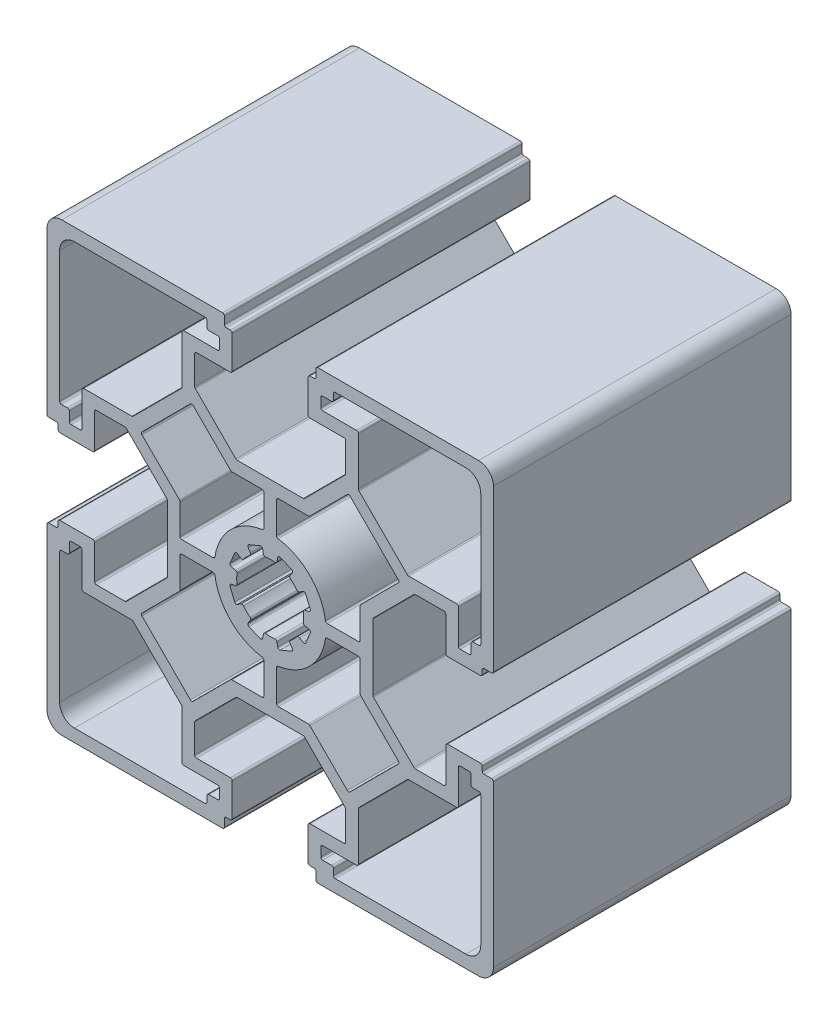
from build123d import *

# Parameters (mm, degrees)
Y_KSEKLIK_EKSTR_ZYON2_DEPTH = 40


with BuildPart() as part:
    # Çizim3 → Yükseklik-Ekstrüzyon2 (new body)
    with BuildSketch(Plane.XY):
        with BuildLine():
            Line((-4.433347776, -13.8), (4.433347776, -13.8))
            ThreePointArc((4.433347776, -13.8), (4.529018634, -13.819030117), (4.610124471, -13.873223305))
            Line((4.610124471, -13.873223305), (10.076776695, -19.339875529))
            ThreePointArc((10.076776695, -19.339875529), (10.130969883, -19.420981366), (10.15, -19.516652224))
            Line((10.15, -19.516652224), (10.15, -23.35))
            ThreePointArc((10.15, -23.35), (10.076776695, -23.526776695), (9.9, -23.6))
            Line((9.9, -23.6), (5.35, -23.6))
            ThreePointArc((5.35, -23.6), (5.173223305, -23.673223305), (5.1, -23.85))
            Line((5.1, -23.85), (5.1, -28.25))
            ThreePointArc((5.1, -28.25), (5.173223305, -28.426776695), (5.35, -28.5))
            Line((5.35, -28.5), (5.9, -28.5))
            ThreePointArc((5.9, -28.5), (6.076776695, -28.573223305), (6.15, -28.75))
            Line((6.15, -28.75), (6.15, -29.75))
            ThreePointArc((6.15, -29.75), (6.223223305, -29.926776695), (6.4, -30))
            Line((6.4, -30), (28, -30))
            ThreePointArc((28, -30), (29.414213562, -29.414213562), (30, -28))
            Line((30, -28), (30, -6.4))
            ThreePointArc((30, -6.4), (29.926776695, -6.223223305), (29.75, -6.15))
            Line((29.75, -6.15), (28.75, -6.15))
            ThreePointArc((28.75, -6.15), (28.573223305, -6.076776695), (28.5, -5.9))
            Line((28.5, -5.9), (28.5, -5.35))
            ThreePointArc((28.5, -5.35), (28.426776695, -5.173223305), (28.25, -5.1))
            Line((28.25, -5.1), (23.85, -5.1))
            ThreePointArc((23.85, -5.1), (23.673223305, -5.173223305), (23.6, -5.35))
            Line((23.6, -5.35), (23.6, -9.9))
            ThreePointArc((23.6, -9.9), (23.526776695, -10.076776695), (23.35, -10.15))
            Line((23.35, -10.15), (19.516652224, -10.15))
            ThreePointArc((19.516652224, -10.15), (19.420981366, -10.130969883), (19.339875529, -10.076776695))
            Line((19.339875529, -10.076776695), (13.873223305, -4.610124471))
            ThreePointArc((13.873223305, -4.610124471), (13.819030117, -4.529018634), (13.8, -4.433347776))
            Line((13.8, -4.433347776), (13.8, 4.433347776))
            ThreePointArc((13.8, 4.433347776), (13.819030117, 4.529018634), (13.873223305, 4.610124471))
            Line((13.873223305, 4.610124471), (19.339875529, 10.076776695))
            ThreePointArc((19.339875529, 10.076776695), (19.420981366, 10.130969883), (19.516652224, 10.15))
            Line((19.516652224, 10.15), (23.35, 10.15))
            ThreePointArc((23.35, 10.15), (23.526776695, 10.076776695), (23.6, 9.9))
            Line((23.6, 9.9), (23.6, 5.35))
            ThreePointArc((23.6, 5.35), (23.673223305, 5.173223305), (23.85, 5.1))
            Line((23.85, 5.1), (28.25, 5.1))
            ThreePointArc((28.25, 5.1), (28.426776695, 5.173223305), (28.5, 5.35))
            Line((28.5, 5.35), (28.5, 5.9))
            ThreePointArc((28.5, 5.9), (28.573223305, 6.076776695), (28.75, 6.15))
            Line((28.75, 6.15), (29.75, 6.15))
            ThreePointArc((29.75, 6.15), (29.926776695, 6.223223305), (30, 6.4))
            Line((30, 6.4), (30, 28))
            ThreePointArc((30, 28), (29.414213562, 29.414213562), (28, 30))
            Line((28, 30), (6.4, 30))
            ThreePointArc((6.4, 30), (6.223223305, 29.926776695), (6.15, 29.75))
            Line((6.15, 29.75), (6.15, 28.75))
            ThreePointArc((6.15, 28.75), (6.076776695, 28.573223305), (5.9, 28.5))
            Line((5.9, 28.5), (5.35, 28.5))
            ThreePointArc((5.35, 28.5), (5.173223305, 28.426776695), (5.1, 28.25))
            Line((5.1, 28.25), (5.1, 23.85))
            ThreePointArc((5.1, 23.85), (5.173223305, 23.673223305), (5.35, 23.6))
            Line((5.35, 23.6), (9.9, 23.6))
            ThreePointArc((9.9, 23.6), (10.076776695, 23.526776695), (10.15, 23.35))
            Line((10.15, 23.35), (10.15, 19.516652224))
            ThreePointArc((10.15, 19.516652224), (10.130969883, 19.420981366), (10.076776695, 19.339875529))
            Line((10.076776695, 19.339875529), (4.610124471, 13.873223305))
            ThreePointArc((4.610124471, 13.873223305), (4.529018634, 13.819030117), (4.433347776, 13.8))
            Line((4.433347776, 13.8), (-4.433347776, 13.8))
            ThreePointArc((-4.433347776, 13.8), (-4.529018634, 13.819030117), (-4.610124471, 13.873223305))
            Line((-4.610124471, 13.873223305), (-10.076776695, 19.339875529))
            ThreePointArc((-10.076776695, 19.339875529), (-10.130969883, 19.420981366), (-10.15, 19.516652224))
            Line((-10.15, 19.516652224), (-10.15, 23.35))
            ThreePointArc((-10.15, 23.35), (-10.076776695, 23.526776695), (-9.9, 23.6))
            Line((-9.9, 23.6), (-5.35, 23.6))
            ThreePointArc((-5.35, 23.6), (-5.173223305, 23.673223305), (-5.1, 23.85))
            Line((-5.1, 23.85), (-5.1, 28.25))
            ThreePointArc((-5.1, 28.25), (-5.173223305, 28.426776695), (-5.35, 28.5))
            Line((-5.35, 28.5), (-5.9, 28.5))
            ThreePointArc((-5.9, 28.5), (-6.076776695, 28.573223305), (-6.15, 28.75))
            Line((-6.15, 28.75), (-6.15, 29.75))
            ThreePointArc((-6.15, 29.75), (-6.223223305, 29.926776695), (-6.4, 30))
            Line((-6.4, 30), (-28, 30))
            ThreePointArc((-28, 30), (-29.414213562, 29.414213562), (-30, 28))
            Line((-30, 28), (-30, 6.4))
            ThreePointArc((-30, 6.4), (-29.926776695, 6.223223305), (-29.75, 6.15))
            Line((-29.75, 6.15), (-28.75, 6.15))
            ThreePointArc((-28.75, 6.15), (-28.573223305, 6.076776695), (-28.5, 5.9))
            Line((-28.5, 5.9), (-28.5, 5.35))
            ThreePointArc((-28.5, 5.35), (-28.426776695, 5.173223305), (-28.25, 5.1))
            Line((-28.25, 5.1), (-23.85, 5.1))
            ThreePointArc((-23.85, 5.1), (-23.673223305, 5.173223305), (-23.6, 5.35))
            Line((-23.6, 5.35), (-23.6, 9.9))
            ThreePointArc((-23.6, 9.9), (-23.526776695, 10.076776695), (-23.35, 10.15))
            Line((-23.35, 10.15), (-19.516652224, 10.15))
            ThreePointArc((-19.516652224, 10.15), (-19.420981366, 10.130969883), (-19.339875529, 10.076776695))
            Line((-19.339875529, 10.076776695), (-13.873223305, 4.610124471))
            ThreePointArc((-13.873223305, 4.610124471), (-13.819030117, 4.529018634), (-13.8, 4.433347776))
            Line((-13.8, 4.433347776), (-13.8, -4.433347776))
            ThreePointArc((-13.8, -4.433347776), (-13.819030117, -4.529018634), (-13.873223305, -4.610124471))
            Line((-13.873223305, -4.610124471), (-19.339875529, -10.076776695))
            ThreePointArc((-19.339875529, -10.076776695), (-19.420981366, -10.130969883), (-19.516652224, -10.15))
            Line((-19.516652224, -10.15), (-23.35, -10.15))
            ThreePointArc((-23.35, -10.15), (-23.526776695, -10.076776695), (-23.6, -9.9))
            Line((-23.6, -9.9), (-23.6, -5.35))
            ThreePointArc((-23.6, -5.35), (-23.673223305, -5.173223305), (-23.85, -5.1))
            Line((-23.85, -5.1), (-28.25, -5.1))
            ThreePointArc((-28.25, -5.1), (-28.426776695, -5.173223305), (-28.5, -5.35))
            Line((-28.5, -5.35), (-28.5, -5.9))
            ThreePointArc((-28.5, -5.9), (-28.573223305, -6.076776695), (-28.75, -6.15))
            Line((-28.75, -6.15), (-29.75, -6.15))
            ThreePointArc((-29.75, -6.15), (-29.926776695, -6.223223305), (-30, -6.4))
            Line((-30, -6.4), (-30, -28))
            ThreePointArc((-30, -28), (-29.414213562, -29.414213562), (-28, -30))
            Line((-28, -30), (-6.4, -30))
            ThreePointArc((-6.4, -30), (-6.223223305, -29.926776695), (-6.15, -29.75))
            Line((-6.15, -29.75), (-6.15, -28.75))
            ThreePointArc((-6.15, -28.75), (-6.076776695, -28.573223305), (-5.9, -28.5))
            Line((-5.9, -28.5), (-5.35, -28.5))
            ThreePointArc((-5.35, -28.5), (-5.173223305, -28.426776695), (-5.1, -28.25))
            Line((-5.1, -28.25), (-5.1, -23.85))
            ThreePointArc((-5.1, -23.85), (-5.173223305, -23.673223305), (-5.35, -23.6))
            Line((-5.35, -23.6), (-9.9, -23.6))
            ThreePointArc((-9.9, -23.6), (-10.076776695, -23.526776695), (-10.15, -23.35))
            Line((-10.15, -23.35), (-10.15, -19.516652224))
            ThreePointArc((-10.15, -19.516652224), (-10.130969883, -19.420981366), (-10.076776695, -19.339875529))
            Line((-10.076776695, -19.339875529), (-4.610124471, -13.873223305))
            ThreePointArc((-4.610124471, -13.873223305), (-4.529018634, -13.819030117), (-4.433347776, -13.8))
        make_face()
        with BuildLine():
            Line((26.3, -28.3), (8.75, -28.3))
            ThreePointArc((8.75, -28.3), (8.573223305, -28.226776695), (8.5, -28.05))
            Line((8.5, -28.05), (8.5, -27.25))
            ThreePointArc((8.5, -27.25), (8.426776695, -27.073223305), (8.25, -27))
            Line((8.25, -27), (7.05, -27))
            ThreePointArc((7.05, -27), (6.873223305, -26.926776695), (6.8, -26.75))
            Line((6.8, -26.75), (6.8, -25.55))
            ThreePointArc((6.8, -25.55), (6.873223305, -25.373223305), (7.05, -25.3))
            Line((7.05, -25.3), (11.6, -25.3))
            ThreePointArc((11.6, -25.3), (11.776776695, -25.226776695), (11.85, -25.05))
            Line((11.85, -25.05), (11.85, -18.605382387))
            ThreePointArc((11.85, -18.605382387), (11.869030117, -18.509711529), (11.923223305, -18.428605692))
            Line((11.923223305, -18.428605692), (18.428605692, -11.923223305))
            ThreePointArc((18.428605692, -11.923223305), (18.509711529, -11.869030117), (18.605382387, -11.85))
            Line((18.605382387, -11.85), (25.05, -11.85))
            ThreePointArc((25.05, -11.85), (25.226776695, -11.776776695), (25.3, -11.6))
            Line((25.3, -11.6), (25.3, -7.05))
            ThreePointArc((25.3, -7.05), (25.373223305, -6.873223305), (25.55, -6.8))
            Line((25.55, -6.8), (26.75, -6.8))
            ThreePointArc((26.75, -6.8), (26.926776695, -6.873223305), (27, -7.05))
            Line((27, -7.05), (27, -8.25))
            ThreePointArc((27, -8.25), (27.073223305, -8.426776695), (27.25, -8.5))
            Line((27.25, -8.5), (28.05, -8.5))
            ThreePointArc((28.05, -8.5), (28.226776695, -8.573223305), (28.3, -8.75))
            Line((28.3, -8.75), (28.3, -26.3))
            ThreePointArc((28.3, -26.3), (27.714213562, -27.714213562), (26.3, -28.3))
        make_face(mode=Mode.SUBTRACT)
        with BuildLine():
            Line((17.226524164, -10.721141777), (10.721141777, -17.226524164))
            ThreePointArc((10.721141777, -17.226524164), (10.544365081, -17.299747468), (10.367588386, -17.226524164))
            Line((10.367588386, -17.226524164), (5.314287527, -12.173223305))
            ThreePointArc((5.314287527, -12.173223305), (5.23318169, -12.119030117), (5.137510832, -12.1))
            Line((5.137510832, -12.1), (1.1, -12.1))
            ThreePointArc((1.1, -12.1), (0.923223305, -12.026776695), (0.85, -11.85))
            Line((0.85, -11.85), (0.85, -7.671538307))
            ThreePointArc((0.85, -7.671538307), (0.911093981, -7.507786922), (1.064516129, -7.42406933))
            ThreePointArc((1.064516129, -7.42406933), (5.303300859, -5.303300859), (7.42406933, -1.064516129))
            ThreePointArc((7.42406933, -1.064516129), (7.507786922, -0.911093981), (7.671538307, -0.85))
            Line((7.671538307, -0.85), (11.85, -0.85))
            ThreePointArc((11.85, -0.85), (12.026776695, -0.923223305), (12.1, -1.1))
            Line((12.1, -1.1), (12.1, -5.137510832))
            ThreePointArc((12.1, -5.137510832), (12.119030117, -5.23318169), (12.173223305, -5.314287527))
            Line((12.173223305, -5.314287527), (17.226524164, -10.367588386))
            ThreePointArc((17.226524164, -10.367588386), (17.299747468, -10.544365081), (17.226524164, -10.721141777))
        make_face(mode=Mode.SUBTRACT)
        with BuildLine():
            Line((0.905086535, -4.656266569), (1.012564457, -5.209192546))
            ThreePointArc((1.012564457, -5.209192546), (1.139641337, -5.381712982), (1.353642111, -5.39246018))
            Line((1.353642111, -5.39246018), (2.855875645, -4.770214677))
            ThreePointArc((2.855875645, -4.770214677), (2.999597627, -4.611293861), (2.96746418, -4.399446568))
            Line((2.96746418, -4.399446568), (2.65248484, -3.932470493))
            ThreePointArc((2.65248484, -3.932470493), (2.613166728, -3.751446862), (2.709231378, -3.593057937))
            ThreePointArc((2.709231378, -3.593057937), (3.181980515, -3.181980515), (3.593057937, -2.709231378))
            ThreePointArc((3.593057937, -2.709231378), (3.751446862, -2.613166728), (3.932470493, -2.65248484))
            Line((3.932470493, -2.65248484), (4.399446568, -2.96746418))
            ThreePointArc((4.399446568, -2.96746418), (4.611293861, -2.999597627), (4.770214677, -2.855875645))
            Line((4.770214677, -2.855875645), (5.39246018, -1.353642111))
            ThreePointArc((5.39246018, -1.353642111), (5.381712982, -1.139641337), (5.209192546, -1.012564457))
            Line((5.209192546, -1.012564457), (4.656266569, -0.905086535))
            ThreePointArc((4.656266569, -0.905086535), (4.500461429, -0.804885602), (4.456391512, -0.624959753))
            ThreePointArc((4.456391512, -0.624959753), (4.5, 0), (4.456391512, 0.624959753))
            ThreePointArc((4.456391512, 0.624959753), (4.500461429, 0.804885602), (4.656266569, 0.905086535))
            Line((4.656266569, 0.905086535), (5.209192546, 1.012564457))
            ThreePointArc((5.209192546, 1.012564457), (5.381712982, 1.139641337), (5.39246018, 1.353642111))
            Line((5.39246018, 1.353642111), (4.770214677, 2.855875645))
            ThreePointArc((4.770214677, 2.855875645), (4.611293861, 2.999597627), (4.399446568, 2.96746418))
            Line((4.399446568, 2.96746418), (3.932470493, 2.65248484))
            ThreePointArc((3.932470493, 2.65248484), (3.751446862, 2.613166728), (3.593057937, 2.709231378))
            ThreePointArc((3.593057937, 2.709231378), (3.181980515, 3.181980515), (2.709231378, 3.593057937))
            ThreePointArc((2.709231378, 3.593057937), (2.613166728, 3.751446862), (2.65248484, 3.932470493))
            Line((2.65248484, 3.932470493), (2.96746418, 4.399446568))
            ThreePointArc((2.96746418, 4.399446568), (2.999597627, 4.611293861), (2.855875645, 4.770214677))
            Line((2.855875645, 4.770214677), (1.353642111, 5.39246018))
            ThreePointArc((1.353642111, 5.39246018), (1.139641337, 5.381712982), (1.012564457, 5.209192546))
            Line((1.012564457, 5.209192546), (0.905086535, 4.656266569))
            ThreePointArc((0.905086535, 4.656266569), (0.804885602, 4.500461429), (0.624959753, 4.456391512))
            ThreePointArc((0.624959753, 4.456391512), (0, 4.5), (-0.624959753, 4.456391512))
            ThreePointArc((-0.624959753, 4.456391512), (-0.804885602, 4.500461429), (-0.905086535, 4.656266569))
            Line((-0.905086535, 4.656266569), (-1.012564457, 5.209192546))
            ThreePointArc((-1.012564457, 5.209192546), (-1.139641337, 5.381712982), (-1.353642111, 5.39246018))
            Line((-1.353642111, 5.39246018), (-2.855875645, 4.770214677))
            ThreePointArc((-2.855875645, 4.770214677), (-2.999597627, 4.611293861), (-2.96746418, 4.399446568))
            Line((-2.96746418, 4.399446568), (-2.65248484, 3.932470493))
            ThreePointArc((-2.65248484, 3.932470493), (-2.613166728, 3.751446862), (-2.709231378, 3.593057937))
            ThreePointArc((-2.709231378, 3.593057937), (-3.181980515, 3.181980515), (-3.593057937, 2.709231378))
            ThreePointArc((-3.593057937, 2.709231378), (-3.751446862, 2.613166728), (-3.932470493, 2.65248484))
            Line((-3.932470493, 2.65248484), (-4.399446568, 2.96746418))
            ThreePointArc((-4.399446568, 2.96746418), (-4.611293861, 2.999597627), (-4.770214677, 2.855875645))
            Line((-4.770214677, 2.855875645), (-5.39246018, 1.353642111))
            ThreePointArc((-5.39246018, 1.353642111), (-5.381712982, 1.139641337), (-5.209192546, 1.012564457))
            Line((-5.209192546, 1.012564457), (-4.656266569, 0.905086535))
            ThreePointArc((-4.656266569, 0.905086535), (-4.500461429, 0.804885602), (-4.456391512, 0.624959753))
            ThreePointArc((-4.456391512, 0.624959753), (-4.5, 0), (-4.456391512, -0.624959753))
            ThreePointArc((-4.456391512, -0.624959753), (-4.500461429, -0.804885602), (-4.656266569, -0.905086535))
            Line((-4.656266569, -0.905086535), (-5.209192546, -1.012564457))
            ThreePointArc((-5.209192546, -1.012564457), (-5.381712982, -1.139641337), (-5.39246018, -1.353642111))
            Line((-5.39246018, -1.353642111), (-4.770214677, -2.855875645))
            ThreePointArc((-4.770214677, -2.855875645), (-4.611293861, -2.999597627), (-4.399446568, -2.96746418))
            Line((-4.399446568, -2.96746418), (-3.932470493, -2.65248484))
            ThreePointArc((-3.932470493, -2.65248484), (-3.751446862, -2.613166728), (-3.593057937, -2.709231378))
            ThreePointArc((-3.593057937, -2.709231378), (-3.181980515, -3.181980515), (-2.709231378, -3.593057937))
            ThreePointArc((-2.709231378, -3.593057937), (-2.613166728, -3.751446862), (-2.65248484, -3.932470493))
            Line((-2.65248484, -3.932470493), (-2.96746418, -4.399446568))
            ThreePointArc((-2.96746418, -4.399446568), (-2.999597627, -4.611293861), (-2.855875645, -4.770214677))
            Line((-2.855875645, -4.770214677), (-1.353642111, -5.39246018))
            ThreePointArc((-1.353642111, -5.39246018), (-1.139641337, -5.381712982), (-1.012564457, -5.209192546))
            Line((-1.012564457, -5.209192546), (-0.905086535, -4.656266569))
            ThreePointArc((-0.905086535, -4.656266569), (-0.804885602, -4.500461429), (-0.624959753, -4.456391512))
            ThreePointArc((-0.624959753, -4.456391512), (0, -4.5), (0.624959753, -4.456391512))
            ThreePointArc((0.624959753, -4.456391512), (0.804885602, -4.500461429), (0.905086535, -4.656266569))
        make_face(mode=Mode.SUBTRACT)
        with BuildLine():
            Line((-0.85, -11.85), (-0.85, -7.671538307))
            ThreePointArc((-0.85, -7.671538307), (-0.911093981, -7.507786922), (-1.064516129, -7.42406933))
            ThreePointArc((-1.064516129, -7.42406933), (-5.303300859, -5.303300859), (-7.42406933, -1.064516129))
            ThreePointArc((-7.42406933, -1.064516129), (-7.507786922, -0.911093981), (-7.671538307, -0.85))
            Line((-7.671538307, -0.85), (-11.85, -0.85))
            ThreePointArc((-11.85, -0.85), (-12.026776695, -0.923223305), (-12.1, -1.1))
            Line((-12.1, -1.1), (-12.1, -5.137510832))
            ThreePointArc((-12.1, -5.137510832), (-12.119030117, -5.23318169), (-12.173223305, -5.314287527))
            Line((-12.173223305, -5.314287527), (-17.226524164, -10.367588386))
            ThreePointArc((-17.226524164, -10.367588386), (-17.299747468, -10.544365081), (-17.226524164, -10.721141777))
            Line((-17.226524164, -10.721141777), (-10.721141777, -17.226524164))
            ThreePointArc((-10.721141777, -17.226524164), (-10.544365081, -17.299747468), (-10.367588386, -17.226524164))
            Line((-10.367588386, -17.226524164), (-5.314287527, -12.173223305))
            ThreePointArc((-5.314287527, -12.173223305), (-5.23318169, -12.119030117), (-5.137510832, -12.1))
            Line((-5.137510832, -12.1), (-1.1, -12.1))
            ThreePointArc((-1.1, -12.1), (-0.923223305, -12.026776695), (-0.85, -11.85))
        make_face(mode=Mode.SUBTRACT)
        with BuildLine():
            Line((-11.923223305, -18.428605692), (-18.428605692, -11.923223305))
            ThreePointArc((-18.428605692, -11.923223305), (-18.509711529, -11.869030117), (-18.605382387, -11.85))
            Line((-18.605382387, -11.85), (-25.05, -11.85))
            ThreePointArc((-25.05, -11.85), (-25.226776695, -11.776776695), (-25.3, -11.6))
            Line((-25.3, -11.6), (-25.3, -7.05))
            ThreePointArc((-25.3, -7.05), (-25.373223305, -6.873223305), (-25.55, -6.8))
            Line((-25.55, -6.8), (-26.75, -6.8))
            ThreePointArc((-26.75, -6.8), (-26.926776695, -6.873223305), (-27, -7.05))
            Line((-27, -7.05), (-27, -8.25))
            ThreePointArc((-27, -8.25), (-27.073223305, -8.426776695), (-27.25, -8.5))
            Line((-27.25, -8.5), (-28.05, -8.5))
            ThreePointArc((-28.05, -8.5), (-28.226776695, -8.573223305), (-28.3, -8.75))
            Line((-28.3, -8.75), (-28.3, -26.3))
            ThreePointArc((-28.3, -26.3), (-27.714213562, -27.714213562), (-26.3, -28.3))
            Line((-26.3, -28.3), (-8.75, -28.3))
            ThreePointArc((-8.75, -28.3), (-8.573223305, -28.226776695), (-8.5, -28.05))
            Line((-8.5, -28.05), (-8.5, -27.25))
            ThreePointArc((-8.5, -27.25), (-8.426776695, -27.073223305), (-8.25, -27))
            Line((-8.25, -27), (-7.05, -27))
            ThreePointArc((-7.05, -27), (-6.873223305, -26.926776695), (-6.8, -26.75))
            Line((-6.8, -26.75), (-6.8, -25.55))
            ThreePointArc((-6.8, -25.55), (-6.873223305, -25.373223305), (-7.05, -25.3))
            Line((-7.05, -25.3), (-11.6, -25.3))
            ThreePointArc((-11.6, -25.3), (-11.776776695, -25.226776695), (-11.85, -25.05))
            Line((-11.85, -25.05), (-11.85, -18.605382387))
            ThreePointArc((-11.85, -18.605382387), (-11.869030117, -18.509711529), (-11.923223305, -18.428605692))
        make_face(mode=Mode.SUBTRACT)
        with BuildLine():
            Line((11.85, 0.85), (7.671538307, 0.85))
            ThreePointArc((7.671538307, 0.85), (7.507786922, 0.911093981), (7.42406933, 1.064516129))
            ThreePointArc((7.42406933, 1.064516129), (5.303300859, 5.303300859), (1.064516129, 7.42406933))
            ThreePointArc((1.064516129, 7.42406933), (0.911093981, 7.507786922), (0.85, 7.671538307))
            Line((0.85, 7.671538307), (0.85, 11.85))
            ThreePointArc((0.85, 11.85), (0.923223305, 12.026776695), (1.1, 12.1))
            Line((1.1, 12.1), (5.137510832, 12.1))
            ThreePointArc((5.137510832, 12.1), (5.23318169, 12.119030117), (5.314287527, 12.173223305))
            Line((5.314287527, 12.173223305), (10.367588386, 17.226524164))
            ThreePointArc((10.367588386, 17.226524164), (10.544365081, 17.299747468), (10.721141777, 17.226524164))
            Line((10.721141777, 17.226524164), (17.226524164, 10.721141777))
            ThreePointArc((17.226524164, 10.721141777), (17.299747468, 10.544365081), (17.226524164, 10.367588386))
            Line((17.226524164, 10.367588386), (12.173223305, 5.314287527))
            ThreePointArc((12.173223305, 5.314287527), (12.119030117, 5.23318169), (12.1, 5.137510832))
            Line((12.1, 5.137510832), (12.1, 1.1))
            ThreePointArc((12.1, 1.1), (12.026776695, 0.923223305), (11.85, 0.85))
        make_face(mode=Mode.SUBTRACT)
        with BuildLine():
            Line((18.428605692, 11.923223305), (11.923223305, 18.428605692))
            ThreePointArc((11.923223305, 18.428605692), (11.869030117, 18.509711529), (11.85, 18.605382387))
            Line((11.85, 18.605382387), (11.85, 25.05))
            ThreePointArc((11.85, 25.05), (11.776776695, 25.226776695), (11.6, 25.3))
            Line((11.6, 25.3), (7.05, 25.3))
            ThreePointArc((7.05, 25.3), (6.873223305, 25.373223305), (6.8, 25.55))
            Line((6.8, 25.55), (6.8, 26.75))
            ThreePointArc((6.8, 26.75), (6.873223305, 26.926776695), (7.05, 27))
            Line((7.05, 27), (8.25, 27))
            ThreePointArc((8.25, 27), (8.426776695, 27.073223305), (8.5, 27.25))
            Line((8.5, 27.25), (8.5, 28.05))
            ThreePointArc((8.5, 28.05), (8.573223305, 28.226776695), (8.75, 28.3))
            Line((8.75, 28.3), (26.3, 28.3))
            ThreePointArc((26.3, 28.3), (27.714213562, 27.714213562), (28.3, 26.3))
            Line((28.3, 26.3), (28.3, 8.75))
            ThreePointArc((28.3, 8.75), (28.226776695, 8.573223305), (28.05, 8.5))
            Line((28.05, 8.5), (27.25, 8.5))
            ThreePointArc((27.25, 8.5), (27.073223305, 8.426776695), (27, 8.25))
            Line((27, 8.25), (27, 7.05))
            ThreePointArc((27, 7.05), (26.926776695, 6.873223305), (26.75, 6.8))
            Line((26.75, 6.8), (25.55, 6.8))
            ThreePointArc((25.55, 6.8), (25.373223305, 6.873223305), (25.3, 7.05))
            Line((25.3, 7.05), (25.3, 11.6))
            ThreePointArc((25.3, 11.6), (25.226776695, 11.776776695), (25.05, 11.85))
            Line((25.05, 11.85), (18.605382387, 11.85))
            ThreePointArc((18.605382387, 11.85), (18.509711529, 11.869030117), (18.428605692, 11.923223305))
        make_face(mode=Mode.SUBTRACT)
        with BuildLine():
            Line((-28.3, 26.3), (-28.3, 8.75))
            ThreePointArc((-28.3, 8.75), (-28.226776695, 8.573223305), (-28.05, 8.5))
            Line((-28.05, 8.5), (-27.25, 8.5))
            ThreePointArc((-27.25, 8.5), (-27.073223305, 8.426776695), (-27, 8.25))
            Line((-27, 8.25), (-27, 7.05))
            ThreePointArc((-27, 7.05), (-26.926776695, 6.873223305), (-26.75, 6.8))
            Line((-26.75, 6.8), (-25.55, 6.8))
            ThreePointArc((-25.55, 6.8), (-25.373223305, 6.873223305), (-25.3, 7.05))
            Line((-25.3, 7.05), (-25.3, 11.6))
            ThreePointArc((-25.3, 11.6), (-25.226776695, 11.776776695), (-25.05, 11.85))
            Line((-25.05, 11.85), (-18.605382387, 11.85))
            ThreePointArc((-18.605382387, 11.85), (-18.509711529, 11.869030117), (-18.428605692, 11.923223305))
            Line((-18.428605692, 11.923223305), (-11.923223305, 18.428605692))
            ThreePointArc((-11.923223305, 18.428605692), (-11.869030117, 18.509711529), (-11.85, 18.605382387))
            Line((-11.85, 18.605382387), (-11.85, 25.05))
            ThreePointArc((-11.85, 25.05), (-11.776776695, 25.226776695), (-11.6, 25.3))
            Line((-11.6, 25.3), (-7.05, 25.3))
            ThreePointArc((-7.05, 25.3), (-6.873223305, 25.373223305), (-6.8, 25.55))
            Line((-6.8, 25.55), (-6.8, 26.75))
            ThreePointArc((-6.8, 26.75), (-6.873223305, 26.926776695), (-7.05, 27))
            Line((-7.05, 27), (-8.25, 27))
            ThreePointArc((-8.25, 27), (-8.426776695, 27.073223305), (-8.5, 27.25))
            Line((-8.5, 27.25), (-8.5, 28.05))
            ThreePointArc((-8.5, 28.05), (-8.573223305, 28.226776695), (-8.75, 28.3))
            Line((-8.75, 28.3), (-26.3, 28.3))
            ThreePointArc((-26.3, 28.3), (-27.714213562, 27.714213562), (-28.3, 26.3))
        make_face(mode=Mode.SUBTRACT)
        with BuildLine():
            Line((-10.367588386, 17.226524164), (-5.314287527, 12.173223305))
            ThreePointArc((-5.314287527, 12.173223305), (-5.23318169, 12.119030117), (-5.137510832, 12.1))
            Line((-5.137510832, 12.1), (-1.1, 12.1))
            ThreePointArc((-1.1, 12.1), (-0.923223305, 12.026776695), (-0.85, 11.85))
            Line((-0.85, 11.85), (-0.85, 7.671538307))
            ThreePointArc((-0.85, 7.671538307), (-0.911093981, 7.507786922), (-1.064516129, 7.42406933))
            ThreePointArc((-1.064516129, 7.42406933), (-5.303300859, 5.303300859), (-7.42406933, 1.064516129))
            ThreePointArc((-7.42406933, 1.064516129), (-7.507786922, 0.911093981), (-7.671538307, 0.85))
            Line((-7.671538307, 0.85), (-11.85, 0.85))
            ThreePointArc((-11.85, 0.85), (-12.026776695, 0.923223305), (-12.1, 1.1))
            Line((-12.1, 1.1), (-12.1, 5.137510832))
            ThreePointArc((-12.1, 5.137510832), (-12.119030117, 5.23318169), (-12.173223305, 5.314287527))
            Line((-12.173223305, 5.314287527), (-17.226524164, 10.367588386))
            ThreePointArc((-17.226524164, 10.367588386), (-17.299747468, 10.544365081), (-17.226524164, 10.721141777))
            Line((-17.226524164, 10.721141777), (-10.721141777, 17.226524164))
            ThreePointArc((-10.721141777, 17.226524164), (-10.544365081, 17.299747468), (-10.367588386, 17.226524164))
        make_face(mode=Mode.SUBTRACT)
    extrude(amount=-Y_KSEKLIK_EKSTR_ZYON2_DEPTH)


solid = part.part
